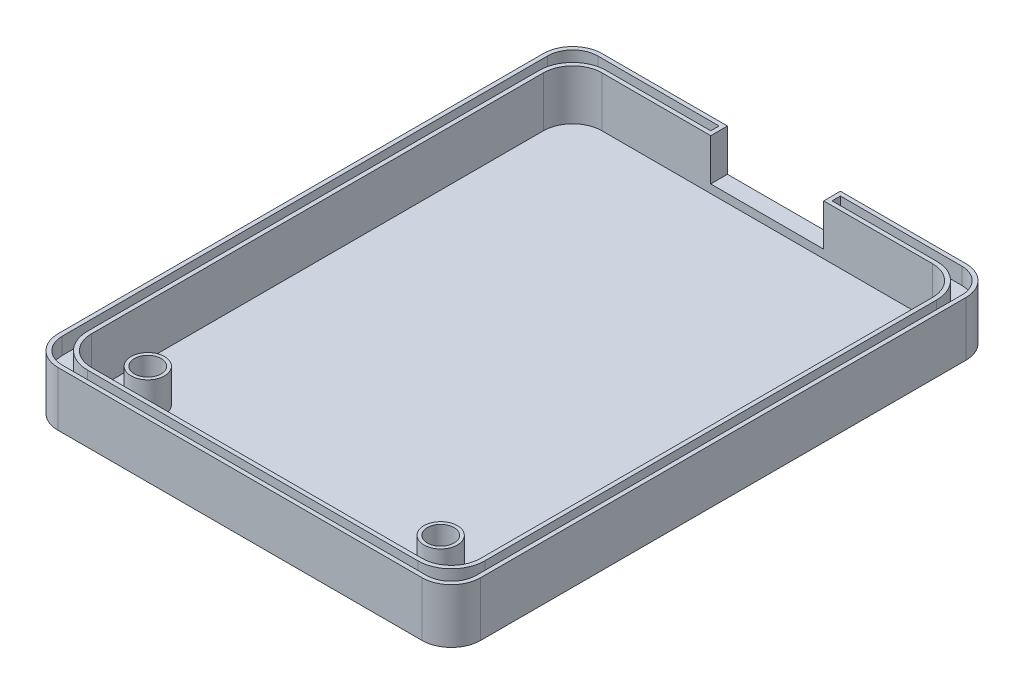
from build123d import *

# Parameters (mm, degrees)
BOSS_EXTRUDE1_DEPTH         = 4.5
CUT_EXTRUDE1_DEPTH          = 4
SKETCH3_W                   = 13.5
SKETCH3_H                   = 6
CUT_EXTRUDE3_DEPTH          = 15
SKETCH4_R                   = 1.6
CUT_EXTRUDE4_DEPTH          = 40
SALIENTE_EXTRUIR1_START     = 4
CROQUIS1_R                  = 2
CROQUIS1_R_2                = 1.6
SALIENTE_EXTRUIR1_DEPTH     = 4
SUPERFICIE_EXTRUIR2_1_DEPTH = 2
DAR_ESPESOR1_T1             = 0.5
SALIENTE_EXTRUIR2_START     = -0.25
CROQUIS3_R                  = 1.6
SALIENTE_EXTRUIR2_DEPTH     = 0.25


with BuildPart() as part:
    # Sketch1 → Boss-Extrude1 (new body)
    with BuildSketch(Plane(origin=(0, 0, 0), x_dir=(1, 0, 0), z_dir=(0, 1, 0))):
        with BuildLine():
            Line((3.5, 0), (47, 0))
            ThreePointArc((47, 0), (49.474873734, 1.025126266), (50.5, 3.5))
            Line((50.5, 3.5), (50.5, 61.5))
            ThreePointArc((50.5, 61.5), (49.474873734, 63.974873734), (47, 65))
            Line((47, 65), (3.5, 65))
            ThreePointArc((3.5, 65), (1.025126266, 63.974873734), (0, 61.5))
            Line((0, 61.5), (0, 3.5))
            ThreePointArc((0, 3.5), (1.025126266, 1.025126266), (3.5, 0))
        make_face()
    extrude(amount=BOSS_EXTRUDE1_DEPTH)

    # Sketch2 → Cut-Extrude1 (cut)
    with BuildSketch(Plane(origin=(0, 4.5, 0), x_dir=(1, 0, 0), z_dir=(0, 1, 0))):
        with BuildLine():
            Line((5.5, 2), (45, 2))
            ThreePointArc((45, 2), (47.474873734, 3.025126266), (48.5, 5.5))
            Line((48.5, 5.5), (48.5, 59.5))
            ThreePointArc((48.5, 59.5), (47.474873734, 61.974873734), (45, 63))
            Line((45, 63), (5.5, 63))
            ThreePointArc((5.5, 63), (3.025126266, 61.974873734), (2, 59.5))
            Line((2, 59.5), (2, 5.5))
            ThreePointArc((2, 5.5), (3.025126266, 3.025126266), (5.5, 2))
        make_face()
    extrude(amount=-CUT_EXTRUDE1_DEPTH, mode=Mode.SUBTRACT)

    # Sketch3 → Cut-Extrude3 (cut)
    with BuildSketch(Plane(origin=(0, 0, -65), x_dir=(-1, 0, 0), z_dir=(0, 0, -1))):
        with Locations((-25.25, 4.5)):
            Rectangle(SKETCH3_W, SKETCH3_H)
    extrude(amount=-CUT_EXTRUDE3_DEPTH, mode=Mode.SUBTRACT)

    # Sketch4 → Cut-Extrude4 (cut)
    with BuildSketch(Plane(origin=(0, 0.5, 0), x_dir=(1, 0, 0), z_dir=(0, 1, 0))):
        with Locations(Location((6.724572176, 7.5, 0), (0, 0, 270))):
            Circle(SKETCH4_R)
        with Locations(Location((41.724572176, 7.5, 0), (0, 0, 270))):
            Circle(SKETCH4_R)
    extrude(amount=-CUT_EXTRUDE4_DEPTH, mode=Mode.SUBTRACT)

    # Croquis1 → Saliente-Extruir1 (add)
    # profile 1 of 2: a face of its own
    with BuildSketch(Plane(origin=(0, 0.5, 0), x_dir=(1, 0, 0), z_dir=(0, 1, 0)).offset(SALIENTE_EXTRUIR1_START)):
        with Locations(Location((6.724572176, 7.5, 0), (0, 0, 90))):
            Circle(CROQUIS1_R)
        with Locations(Location((6.724572176, 7.5, 0), (0, 0, 270))):
            Circle(CROQUIS1_R_2, mode=Mode.SUBTRACT)
    # profile 2 of 2: a face of its own
    with BuildSketch(Plane(origin=(0, 0.5, 0), x_dir=(1, 0, 0), z_dir=(0, 1, 0)).offset(SALIENTE_EXTRUIR1_START)):
        with Locations(Location((41.724572176, 7.5, 0), (0, 0, 90))):
            Circle(CROQUIS1_R)
        with Locations(Location((41.724572176, 7.5, 0), (0, 0, 270))):
            Circle(CROQUIS1_R_2, mode=Mode.SUBTRACT)
    extrude(amount=-SALIENTE_EXTRUIR1_DEPTH)

    # Superficie-Extruir2: a surface, the sketch's curves swept straight by 2 mm
    with BuildLine(Plane(origin=(0, 4.5, 0), x_dir=(1, 0, 0), z_dir=(0, 1, 0)), mode=Mode.PRIVATE) as superficie_extruir2_1_path:
        Line((18.5, 63), (18.5, 65))
        Line((18.5, 65), (3.5, 65))
        ThreePointArc((3.5, 65), (1.025126266, 63.974873734), (0, 61.5))
        Line((0, 61.5), (0, 3.5))
        ThreePointArc((0, 3.5), (1.025126266, 1.025126266), (3.5, 0))
        Line((3.5, 0), (47, 0))
        ThreePointArc((47, 0), (49.474873734, 1.025126266), (50.5, 3.5))
        Line((50.5, 3.5), (50.5, 61.5))
        ThreePointArc((50.5, 61.5), (49.474873734, 63.974873734), (47, 65))
        Line((47, 65), (32, 65))
        Line((32, 65), (32, 63))
        Line((32, 63), (45, 63))
        ThreePointArc((45, 63), (47.474873734, 61.974873734), (48.5, 59.5))
        Line((48.5, 59.5), (48.5, 5.5))
        ThreePointArc((48.5, 5.5), (47.474873734, 3.025126266), (45, 2))
        Line((45, 2), (5.5, 2))
        ThreePointArc((5.5, 2), (3.025126266, 3.025126266), (2, 5.5))
        Line((2, 5.5), (2, 59.5))
        ThreePointArc((2, 59.5), (3.025126266, 61.974873734), (5.5, 63))
        Line((5.5, 63), (18.5, 63))
    superficie_extruir2_1 = Shell.extrude(superficie_extruir2_1_path.wire(), (0 * SUPERFICIE_EXTRUIR2_1_DEPTH, 1 * SUPERFICIE_EXTRUIR2_1_DEPTH, 0 * SUPERFICIE_EXTRUIR2_1_DEPTH))
    add(Solid.thicken(superficie_extruir2_1, DAR_ESPESOR1_T1))

    # Croquis3 → Saliente-Extruir2 (add)
    with BuildSketch(Plane.XZ.offset(SALIENTE_EXTRUIR2_START)):
        with Locations(Location((6.724572176, -7.5, 0), (0, 0, 90))):
            Circle(CROQUIS3_R)
        with Locations(Location((41.724572176, -7.5, 0), (0, 0, 90))):
            Circle(CROQUIS3_R)
    extrude(amount=SALIENTE_EXTRUIR2_DEPTH)


solid = part.part
